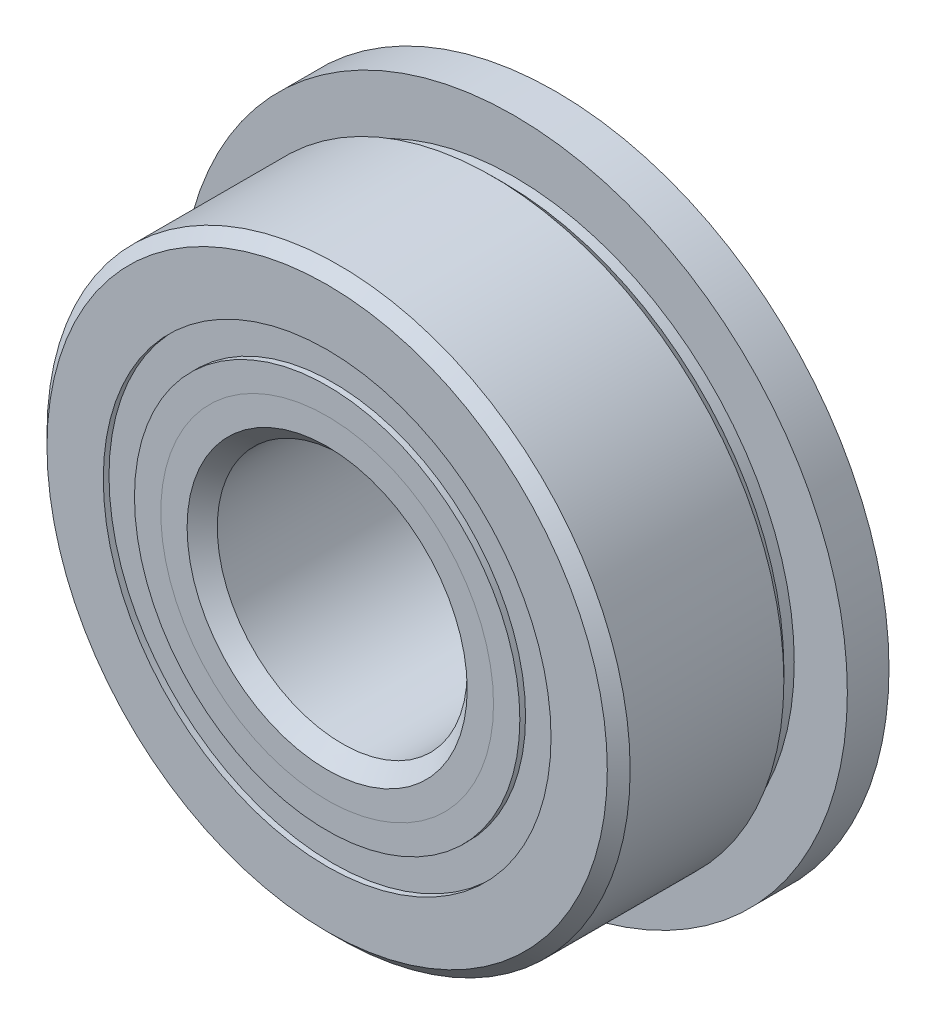
from build123d import *

# Parameters (mm, degrees)
SKETCH5_W         = 1.5875
SKETCH5_H         = 3.095820385
CIRPATTERN1_COUNT = 12
SKETCH7_W         = 2.113185734
SKETCH7_H         = 1.187938462


with BuildPart() as part:
    # Sketch1 → Revolve1 (revolve)
    with BuildSketch(Plane(origin=(0, 0, 0), x_dir=(0, 0, -1), z_dir=(1, 0, 0))):
        with BuildLine():
            Line((3.92049, 11.1125), (-3.92049, 11.1125))
            Line((-3.92049, 11.1125), (-4.3561, 10.67689))
            Line((-4.3561, 10.67689), (-4.3561, 8.531469231))
            Line((-4.3561, 8.531469231), (-1.936044444, 8.531469231))
            ThreePointArc((-1.936044444, 8.531469231), (0, 9.962609266), (1.936044444, 8.531469231))
            Line((1.936044444, 8.531469231), (4.3561, 8.531469231))
            Line((4.3561, 8.531469231), (4.3561, 10.67689))
            Line((4.3561, 10.67689), (3.92049, 11.1125))
        make_face()
    revolve(axis=Axis((0, 0, 4.3561), (0, 0, -1)))

    # Sketch5 → Revolve5 (revolve)
    with BuildSketch(Plane(origin=(0, 0, 0), x_dir=(0, 0, -1), z_dir=(1, 0, 0))):
        with Locations((3.56235, 11.152089808)):
            Rectangle(SKETCH5_W, SKETCH5_H)
    revolve(axis=Axis((0, 0, -5.96265), (0, 0, 1)))

    # Sketch6 → Cut-Revolve1 (revolve, cut)
    with BuildSketch(Plane(origin=(0, 0, 0), x_dir=(0, 0, -1), z_dir=(1, 0, 0))):
        Polygon((1.936115, 11.1125), (2.371725, 10.67689), (2.7686, 10.67689), (2.7686, 11.1125), align=None)
    revolve(axis=Axis((0, 0, 4.3561), (0, 0, -1)), mode=Mode.SUBTRACT)


with BuildPart() as body_2:
    # Sketch2 → Revolve2 (revolve)
    with BuildSketch(Plane(origin=(0, 0, 0), x_dir=(0, 0, -1), z_dir=(1, 0, 0))):
        with BuildLine():
            Line((-4.3561, 7.343530769), (-1.936044444, 7.343530769))
            ThreePointArc((-1.936044444, 7.343530769), (-1.203788799, 6.309016022), (0, 5.912390734))
            Line((0, 5.912390734), (0, 5.337445367))
            Line((0, 5.337445367), (-3.353057299, 5.337445367))
            Line((-3.353057299, 5.337445367), (-4.3561, 6.340488068))
            Line((-4.3561, 6.340488068), (-4.3561, 7.343530769))
        make_face()
    revolve(axis=Axis((0, 0, 4.3561), (0, 0, -1)))


with BuildPart() as body_3:
    # Sketch3 → Revolve3 (revolve)
    with BuildSketch(Plane(origin=(0, 0, 0), x_dir=(0, 0, -1), z_dir=(1, 0, 0))):
        with BuildLine():
            Line((-4.3561, 6.340488068), (-3.353057299, 5.337445367))
            Line((-3.353057299, 5.337445367), (0, 5.337445367))
            Line((0, 5.337445367), (0, 5.912390734))
            ThreePointArc((0, 5.912390734), (1.203788799, 6.309016022), (1.936044444, 7.343530769))
            Line((1.936044444, 7.343530769), (5.96265, 7.343530769))
            Line((5.96265, 7.343530769), (5.96265, 5.19811))
            Line((5.96265, 5.19811), (5.52704, 4.7625))
            Line((5.52704, 4.7625), (-3.781154633, 4.7625))
            Line((-3.781154633, 4.7625), (-4.3561, 5.337445367))
            Line((-4.3561, 5.337445367), (-4.3561, 6.340488068))
        make_face()
    revolve(axis=Axis((0, 0, 4.3561), (0, 0, -1)))


with BuildPart() as body_4:
    # Sketch4 → Revolve4 (revolve)
    with BuildSketch(Plane(origin=(0, 0, 0), x_dir=(0, 0, -1), z_dir=(1, 0, 0))):
        with BuildLine():
            Line((-2.025109266, 7.9375), (2.025109266, 7.9375))
            ThreePointArc((2.025109266, 7.9375), (0, 9.962609266), (-2.025109266, 7.9375))
        make_face()
    revolve(axis=Axis((0, 7.9375, 2.025109266), (0, 0, -1)))


with BuildPart() as cirpattern1_1:
    # CirPattern1: pattern copy
    add(body_4.part.rotate(Axis((0, 0, -4.3561), (0, 0, 1)), 1 * 360 / CIRPATTERN1_COUNT))


with BuildPart() as cirpattern1_2:
    # CirPattern1: pattern copy
    add(body_4.part.rotate(Axis((0, 0, -4.3561), (0, 0, 1)), 2 * 360 / CIRPATTERN1_COUNT))


with BuildPart() as cirpattern1_3:
    # CirPattern1: pattern copy
    add(body_4.part.rotate(Axis((0, 0, -4.3561), (0, 0, 1)), 3 * 360 / CIRPATTERN1_COUNT))


with BuildPart() as cirpattern1_4:
    # CirPattern1: pattern copy
    add(body_4.part.rotate(Axis((0, 0, -4.3561), (0, 0, 1)), 4 * 360 / CIRPATTERN1_COUNT))


with BuildPart() as cirpattern1_5:
    # CirPattern1: pattern copy
    add(body_4.part.rotate(Axis((0, 0, -4.3561), (0, 0, 1)), 5 * 360 / CIRPATTERN1_COUNT))


with BuildPart() as cirpattern1_6:
    # CirPattern1: pattern copy
    add(body_4.part.rotate(Axis((0, 0, -4.3561), (0, 0, 1)), 6 * 360 / CIRPATTERN1_COUNT))


with BuildPart() as cirpattern1_7:
    # CirPattern1: pattern copy
    add(body_4.part.rotate(Axis((0, 0, -4.3561), (0, 0, 1)), 7 * 360 / CIRPATTERN1_COUNT))


with BuildPart() as cirpattern1_8:
    # CirPattern1: pattern copy
    add(body_4.part.rotate(Axis((0, 0, -4.3561), (0, 0, 1)), 8 * 360 / CIRPATTERN1_COUNT))


with BuildPart() as cirpattern1_9:
    # CirPattern1: pattern copy
    add(body_4.part.rotate(Axis((0, 0, -4.3561), (0, 0, 1)), 9 * 360 / CIRPATTERN1_COUNT))


with BuildPart() as cirpattern1_10:
    # CirPattern1: pattern copy
    add(body_4.part.rotate(Axis((0, 0, -4.3561), (0, 0, 1)), 10 * 360 / CIRPATTERN1_COUNT))


with BuildPart() as cirpattern1_11:
    # CirPattern1: pattern copy
    add(body_4.part.rotate(Axis((0, 0, -4.3561), (0, 0, 1)), 11 * 360 / CIRPATTERN1_COUNT))


with BuildPart() as body_16:
    # Sketch7 → Revolve6 (revolve)
    with BuildSketch(Plane(origin=(0, 0, 0), x_dir=(0, 0, -1), z_dir=(1, 0, 0))):
        with Locations((-3.081702133, 7.9375)):
            Rectangle(SKETCH7_W, SKETCH7_H)
        with Locations((3.081702133, 7.9375)):
            Rectangle(SKETCH7_W, SKETCH7_H)
    revolve(axis=Axis((0, 0, 4.3561), (0, 0, -1)))


solid = Compound([part.part, body_2.part, body_3.part, body_4.part, cirpattern1_1.part, cirpattern1_2.part, cirpattern1_3.part, cirpattern1_4.part, cirpattern1_5.part, cirpattern1_6.part, cirpattern1_7.part, cirpattern1_8.part, cirpattern1_9.part, cirpattern1_10.part, cirpattern1_11.part, body_16.part])
